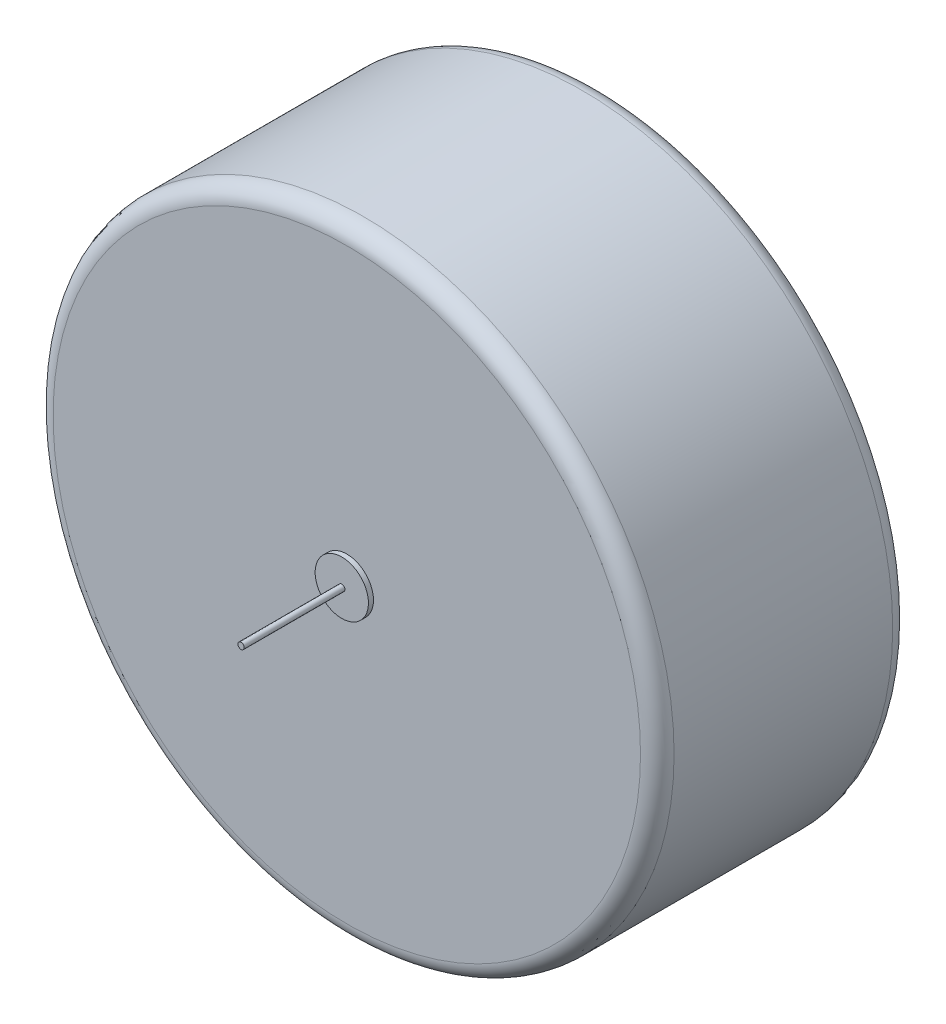
from build123d import *

# Parameters (mm, degrees)
SKETCH1_R           = 37
BOSS_EXTRUDE1_DEPTH = 30.05
SKETCH2_R           = 3.175
BOSS_EXTRUDE2_DEPTH = 0.6
SKETCH3_R           = 0.375
BOSS_EXTRUDE3_DEPTH = 12
FILLET1_R           = 2


with BuildPart() as part:
    # Sketch1 → Boss-Extrude1 (new body)
    with BuildSketch(Plane.XY):
        Circle(SKETCH1_R)
    extrude(amount=-BOSS_EXTRUDE1_DEPTH)

    # Sketch2 → Boss-Extrude2 (add)
    with BuildSketch(Plane.XY):
        Circle(SKETCH2_R)
    extrude(amount=BOSS_EXTRUDE2_DEPTH)

    # Sketch3 → Boss-Extrude3 (add)
    with BuildSketch(Plane.XY.offset(0.6)):
        Circle(SKETCH3_R)
    extrude(amount=BOSS_EXTRUDE3_DEPTH)

    # Fillet1
    fillet1_edges = [part.edges().sort_by_distance(p)[0] for p in [
        (-37, 0, 0),
        (-37, 0, -30.05),
    ]]
    fillet(fillet1_edges, radius=FILLET1_R)


solid = part.part
